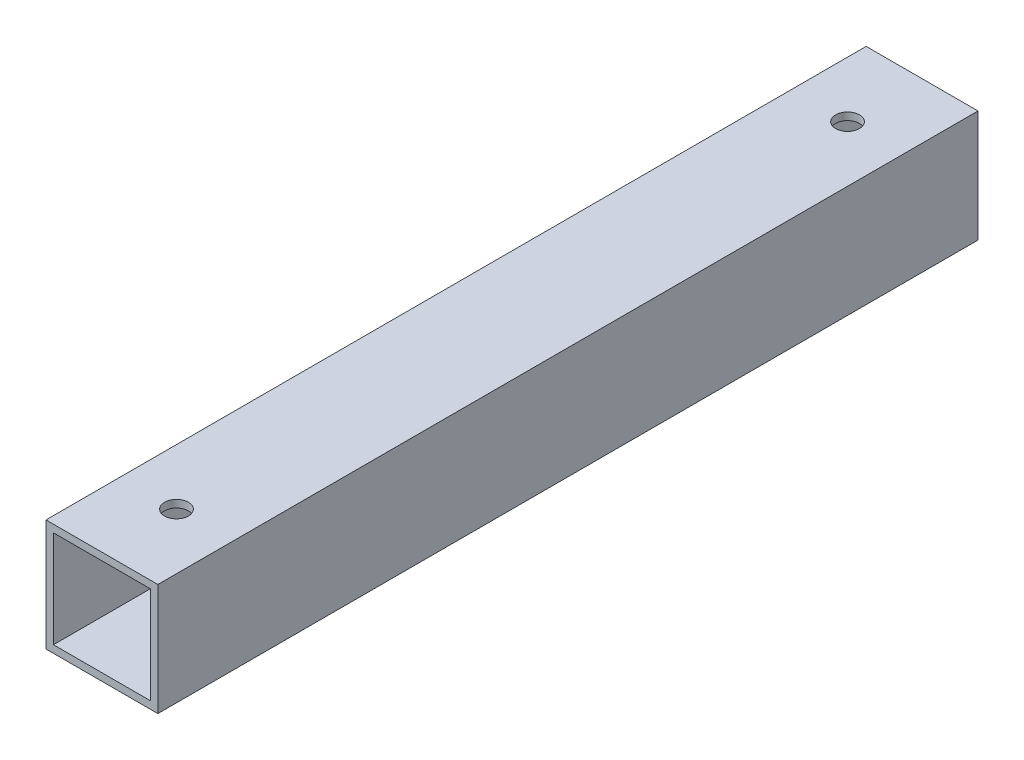
from build123d import *

# Parameters (mm, degrees)
SKETCH_1_W          = 15
SKETCH_1_H          = 15
SKETCH_1_W_2        = 13
SKETCH_1_H_2        = 13
EXTRUDE_1_DEPTH     = 110
SKETCH_2_R          = 1.6
CUT_EXTRUDE_1_DEPTH = 32


with BuildPart() as part:
    # 草图1 → 拉伸-薄壁1 (new body)
    with BuildSketch(Plane.XY):
        with Locations((6.5, 6.5)):
            Rectangle(SKETCH_1_W, SKETCH_1_H)
        with Locations((6.5, 6.5)):
            Rectangle(SKETCH_1_W_2, SKETCH_1_H_2, mode=Mode.SUBTRACT)
    extrude(amount=EXTRUDE_1_DEPTH)

    # 草图2 → 切除-拉伸1 (cut)
    with BuildSketch(Plane(origin=(0, 14, 0), x_dir=(1, 0, 0), z_dir=(0, 1, 0))):
        with Locations(Location((6.5, -10, 0), (0, 0, 270))):
            Circle(SKETCH_2_R)
        with Locations(Location((6.5, -100, 0), (0, 0, 270))):
            Circle(SKETCH_2_R)
    extrude(amount=-CUT_EXTRUDE_1_DEPTH, mode=Mode.SUBTRACT)


solid = part.part
